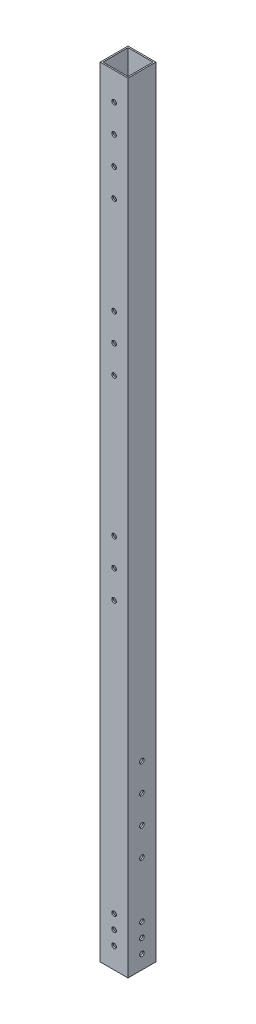
from build123d import *

# Parameters (mm, degrees)
SKETCH_1_W          = 20
SKETCH_1_H          = 20
SKETCH_1_W_2        = 18
SKETCH_1_H_2        = 18
EXTRUDE_1_DEPTH     = 740
SKETCH_3_R          = 1.65
CUT_EXTRUDE_1_DEPTH = 32
SKETCH_4_R          = 1.65
CUT_EXTRUDE_2_DEPTH = 741.337760755
SKETCH_5_R          = 14.566227152
CUT_EXTRUDE_3_DEPTH = 180
SKETCH_6_R          = 1.65
CUT_EXTRUDE_4_DEPTH = 30
SKETCH_7_R          = 1.65
CUT_EXTRUDE_5_DEPTH = 741.337760755


with BuildPart() as part:
    # 草图1 → 凸台-拉伸1 (new body)
    with BuildSketch(Plane(origin=(0, 0, 0), x_dir=(1, 0, 0), z_dir=(0, 1, 0))):
        Rectangle(SKETCH_1_W, SKETCH_1_H)
        Rectangle(SKETCH_1_W_2, SKETCH_1_H_2, mode=Mode.SUBTRACT)
    extrude(amount=EXTRUDE_1_DEPTH)

    # 草图3 → 切除-拉伸1 (cut)
    with BuildSketch(Plane.XY.offset(10)):
        with Locations((0, 720)):
            Circle(SKETCH_3_R)
        with Locations((0, 700)):
            Circle(SKETCH_3_R)
        with Locations((0, 680)):
            Circle(SKETCH_3_R)
        with Locations((0, 660)):
            Circle(SKETCH_3_R)
        with Locations((0, 590)):
            Circle(SKETCH_3_R)
        with Locations((0, 570)):
            Circle(SKETCH_3_R)
        with Locations((0, 550)):
            Circle(SKETCH_3_R)
        with Locations((0, 450)):
            Circle(SKETCH_3_R)
        with Locations((0, 430)):
            Circle(SKETCH_3_R)
        with Locations((0, 410)):
            Circle(SKETCH_3_R)
    extrude(amount=-CUT_EXTRUDE_1_DEPTH, mode=Mode.SUBTRACT)

    # 草图4 → 切除-拉伸2 (cut, through all)
    with BuildSketch(Plane(origin=(10, 0, 0), x_dir=(0, 0, -1), z_dir=(1, 0, 0))):
        with Locations((0, 250)):
            Circle(SKETCH_4_R)
        with Locations((0, 270)):
            Circle(SKETCH_4_R)
        with Locations((0, 290)):
            Circle(SKETCH_4_R)
        with Locations((0, 310)):
            Circle(SKETCH_4_R)
    extrude(amount=-CUT_EXTRUDE_2_DEPTH, mode=Mode.SUBTRACT)

    # 草图5 → 切除-拉伸3 (cut)
    with BuildSketch(Plane.XZ):
        Circle(SKETCH_5_R)
    extrude(amount=-CUT_EXTRUDE_3_DEPTH, mode=Mode.SUBTRACT)

    # 草图6 → 切除-拉伸4 (cut)
    with BuildSketch(Plane(origin=(10, 0, 0), x_dir=(0, 0, -1), z_dir=(1, 0, 0))):
        with Locations((0, 190)):
            Circle(SKETCH_6_R)
        with Locations((0, 200)):
            Circle(SKETCH_6_R)
        with Locations((0, 210)):
            Circle(SKETCH_6_R)
    extrude(amount=-CUT_EXTRUDE_4_DEPTH, mode=Mode.SUBTRACT)

    # 草图7 → 切除-拉伸5 (cut, through all)
    with BuildSketch(Plane(origin=(0, 0, -10), x_dir=(-1, 0, 0), z_dir=(0, 0, -1))):
        with Locations((0, 195)):
            Circle(SKETCH_7_R)
        with Locations((0, 205)):
            Circle(SKETCH_7_R)
        with Locations((0, 215)):
            Circle(SKETCH_7_R)
    extrude(amount=-CUT_EXTRUDE_5_DEPTH, mode=Mode.SUBTRACT)


solid = part.part
